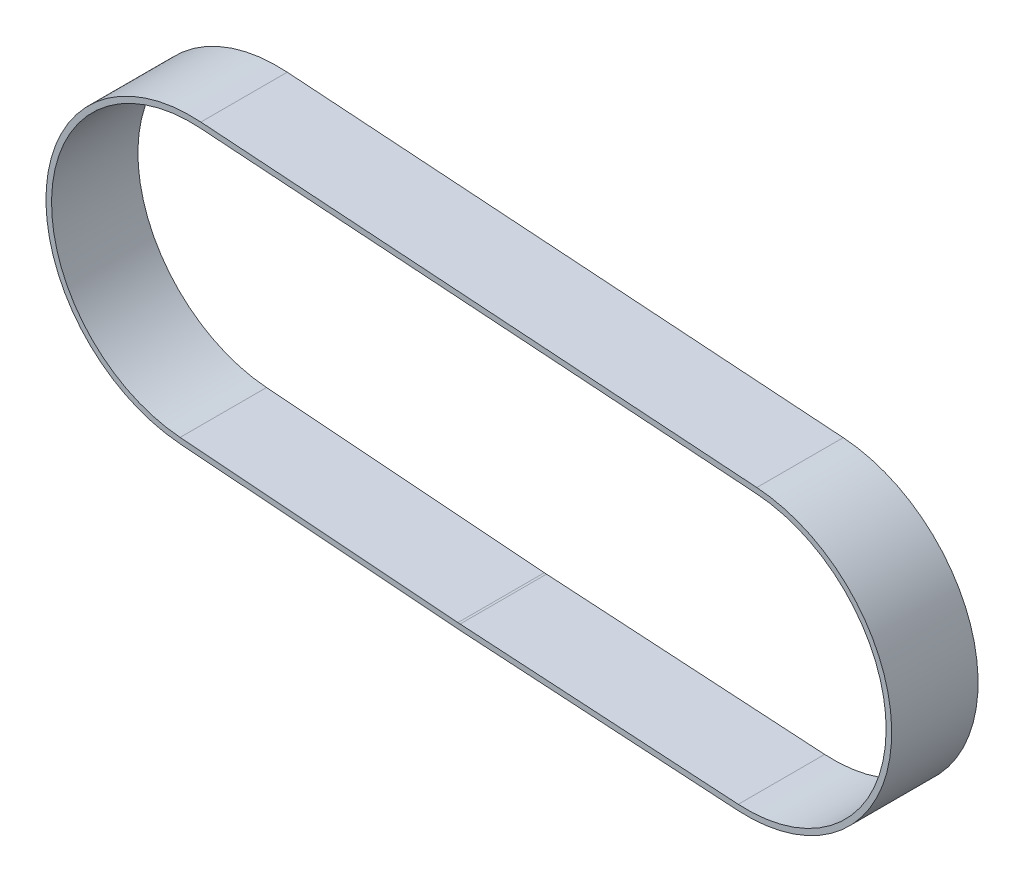
from build123d import *

# Parameters (mm, degrees)
EXTRUDE_THIN2_DEPTH      = 1
EXTRUDE_THIN2_DEPTH_BACK = 30


with BuildPart() as part:
    # Sketch2 → Extrude-Thin2 (new, two sides: drawn at the far end of the back side and taken through both)
    with BuildSketch(Plane.XY.offset(-EXTRUDE_THIN2_DEPTH_BACK)):
        with BuildLine():
            Line((203.150311833, 38.600349755), (3.634824321, 52.423187112))
            ThreePointArc((3.634824321, 52.423187112), (-51.820262836, 4.346595446), (-3.963228019, -51.298077043))
            Line((-3.963228019, -51.298077043), (95.739880914, -58.998081537))
            ThreePointArc((95.739880914, -58.998081537), (96.149833249, -59.028112402), (96.560010162, -59.054901754))
            Line((96.560010162, -59.054901754), (196.372388742, -65.177734616))
            ThreePointArc((196.372388742, -65.177734616), (251.445709315, -16.664285771), (203.150311833, 38.600349755))
        make_face()
        with BuildLine():
            Line((203.01207914, 36.605132543), (3.496591628, 50.4279699))
            ThreePointArc((3.496591628, 50.4279699), (-49.82560756, 4.200477913), (-3.809227929, -49.304014864))
            Line((-3.809227929, -49.304014864), (95.893881004, -57.004019358))
            ThreePointArc((95.893881004, -57.004019358), (96.288065941, -57.03289519), (96.68246682, -57.058654182))
            Line((96.68246682, -57.058654182), (196.494845399, -63.181487045))
            ThreePointArc((196.494845399, -63.181487045), (249.449961335, -16.533940078), (203.01207914, 36.605132543))
        make_face(mode=Mode.SUBTRACT)
    extrude(amount=EXTRUDE_THIN2_DEPTH + EXTRUDE_THIN2_DEPTH_BACK)


solid = part.part
